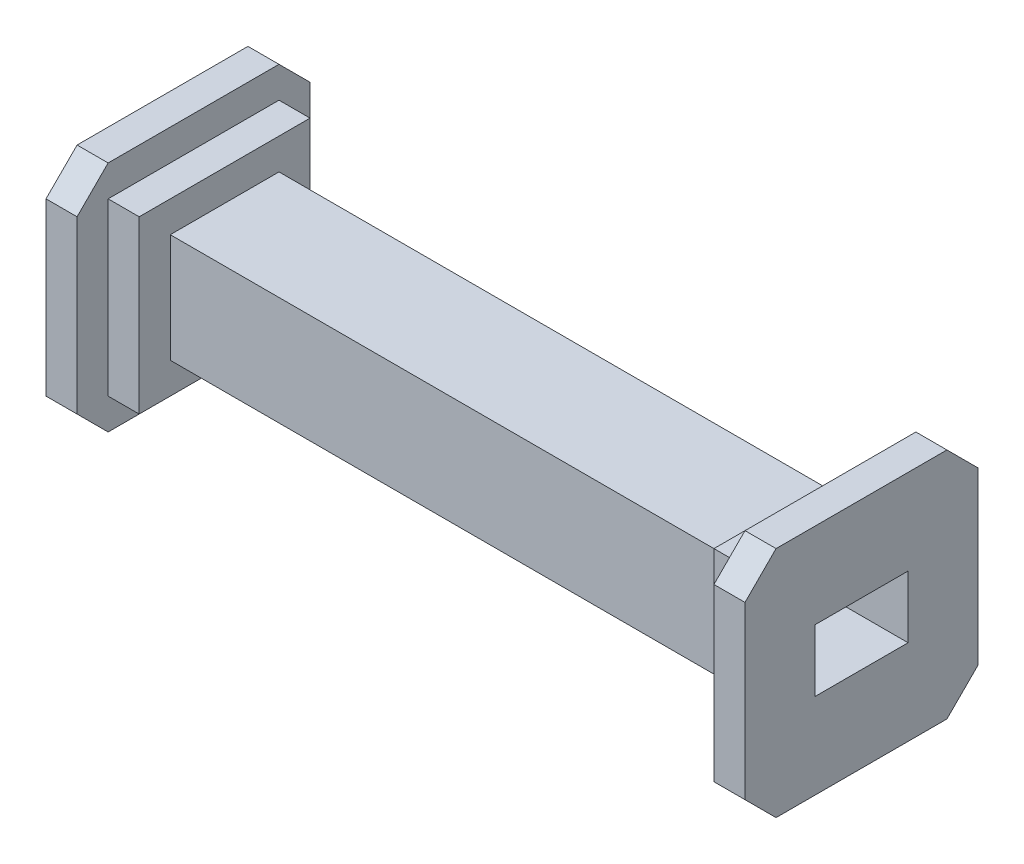
from build123d import *

# Parameters (mm, degrees)
SKETCH1_W           = 38.1
SKETCH1_H           = 38.1
BOSS_EXTRUDE1_DEPTH = 114.3
CUT_EXTRUDE1_START  = -5.08
SKETCH3_W           = 38.1
SKETCH3_H           = 38.1
SKETCH3_W_2         = 27.94
SKETCH3_H_2         = 27.94
CUT_EXTRUDE1_DEPTH  = 104.14
CUT_EXTRUDE2_START  = -93.98
SKETCH4_W           = 38.1
SKETCH4_H           = 38.1
SKETCH4_W_2         = 17.78
SKETCH4_H_2         = 17.78
CUT_EXTRUDE2_DEPTH  = 93.98
SKETCH5_W           = 15.24
SKETCH5_H           = 10.16
CUT_EXTRUDE3_DEPTH  = 118.432086757
CHAMFER1_SIZE       = 5.08


with BuildPart() as part:
    # Sketch1 → Boss-Extrude1 (new body)
    with BuildSketch(Plane(origin=(0, 0, 0), x_dir=(0, 0, -1), z_dir=(1, 0, 0))):
        Rectangle(SKETCH1_W, SKETCH1_H)
    extrude(amount=BOSS_EXTRUDE1_DEPTH)

    # Sketch3 → Cut-Extrude1 (cut)
    with BuildSketch(Plane.ZY.offset(CUT_EXTRUDE1_START)):
        Rectangle(SKETCH3_W, SKETCH3_H)
        Rectangle(SKETCH3_W_2, SKETCH3_H_2, mode=Mode.SUBTRACT)
    extrude(amount=-CUT_EXTRUDE1_DEPTH, mode=Mode.SUBTRACT)

    # Sketch4 → Cut-Extrude2 (cut)
    with BuildSketch(Plane.ZY.offset(-10.16).offset(CUT_EXTRUDE2_START)):
        Rectangle(SKETCH4_W, SKETCH4_H)
        Rectangle(SKETCH4_W_2, SKETCH4_H_2, mode=Mode.SUBTRACT)
    extrude(amount=CUT_EXTRUDE2_DEPTH, mode=Mode.SUBTRACT)

    # Sketch5 → Cut-Extrude3 (cut, through all)
    with BuildSketch(Plane.ZY):
        Rectangle(SKETCH5_W, SKETCH5_H)
    extrude(amount=-CUT_EXTRUDE3_DEPTH, mode=Mode.SUBTRACT)

    # Chamfer1
    chamfer1_edges = [part.edges().sort_by_distance(p)[0] for p in [
        (2.54, -19.05, -19.05),
        (2.54, -19.05, 19.05),
        (2.54, 19.05, 19.05),
        (2.54, 19.05, -19.05),
        (111.76, -19.05, -19.05),
        (111.76, -19.05, 19.05),
        (111.76, 19.05, 19.05),
        (111.76, 19.05, -19.05),
    ]]
    chamfer(chamfer1_edges, length=CHAMFER1_SIZE)


solid = part.part
